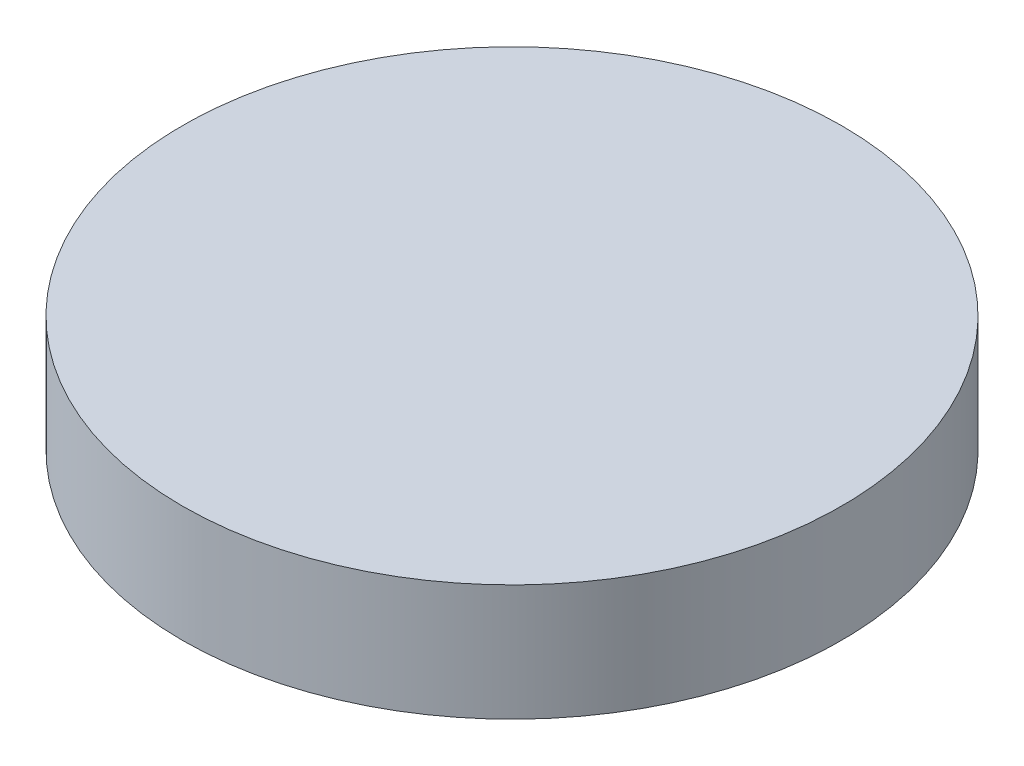
from build123d import *

# Parameters (mm, degrees)
SKETCH2_R           = 17
BOSS_EXTRUDE1_DEPTH = 6


with BuildPart() as part:
    # Sketch2 → Boss-Extrude1 (new body)
    with BuildSketch(Plane(origin=(0, 0, 0), x_dir=(1, 0, 0), z_dir=(0, 1, 0))):
        with Locations(Location((0, 0, 0), (0, 0, 270))):
            Circle(SKETCH2_R)
    extrude(amount=BOSS_EXTRUDE1_DEPTH)


solid = part.part
